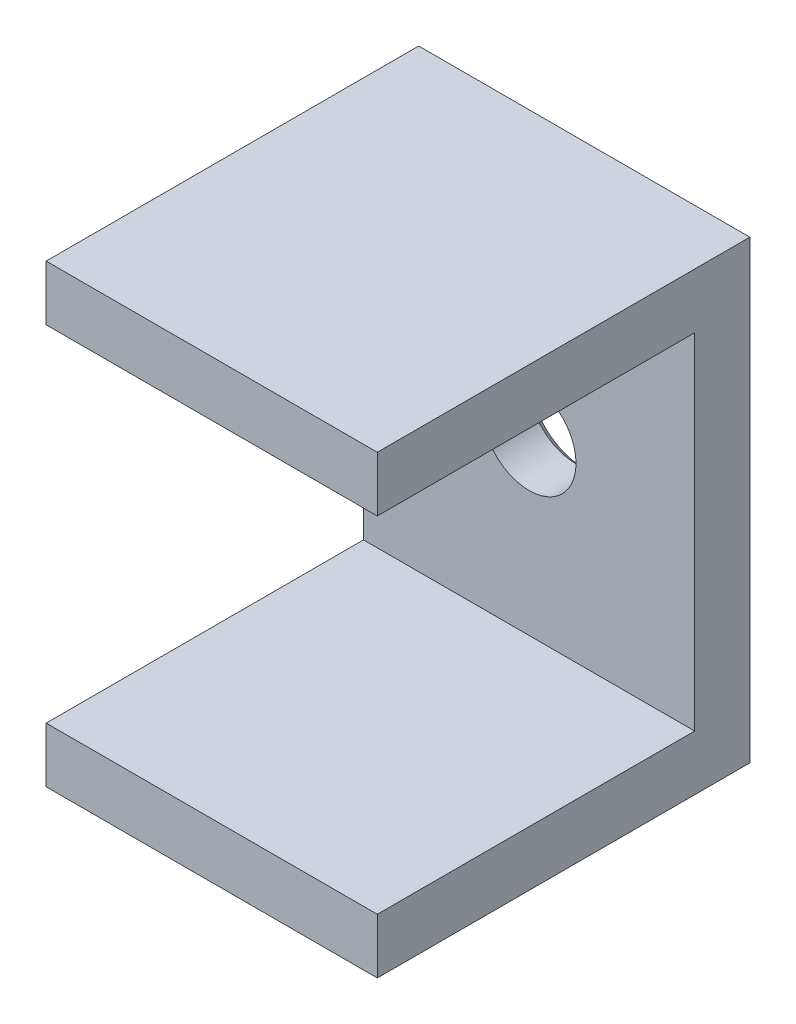
from build123d import *

# Parameters (mm, degrees)
SKETCH_1_W          = 24
SKETCH_1_H          = 27
EXTRUDE_1_DEPTH     = 33
SKETCH_3_W          = 24
SKETCH_3_H          = 25
CUT_EXTRUDE_1_DEPTH = 23


with BuildPart() as part:
    # 草图1 → 凸台-拉伸1 (new body)
    with BuildSketch(Plane(origin=(0, 0, 0), x_dir=(1, 0, 0), z_dir=(0, 1, 0))):
        Rectangle(SKETCH_1_W, SKETCH_1_H)
    extrude(amount=EXTRUDE_1_DEPTH)

    # 草图3 → 切除-拉伸1 (cut)
    with BuildSketch(Plane.XY.offset(13.5)):
        with Locations((0, 16.5)):
            Rectangle(SKETCH_3_W, SKETCH_3_H)
    extrude(amount=-CUT_EXTRUDE_1_DEPTH, mode=Mode.SUBTRACT)

    # 草图5 → M8 螺纹孔1 (revolve, cut)
    with BuildSketch(Plane(origin=(0, 16.5, -13.5), x_dir=(0, 1, 0), z_dir=(1, 0, 0))):
        Polygon((0, 0), (0, 4), (3.4, 4), (3.4, 0.625), (4.025, 0), align=None)
    revolve(axis=Axis((0, 16.5, -19.85), (0, 0, 1)), mode=Mode.SUBTRACT)


solid = part.part
